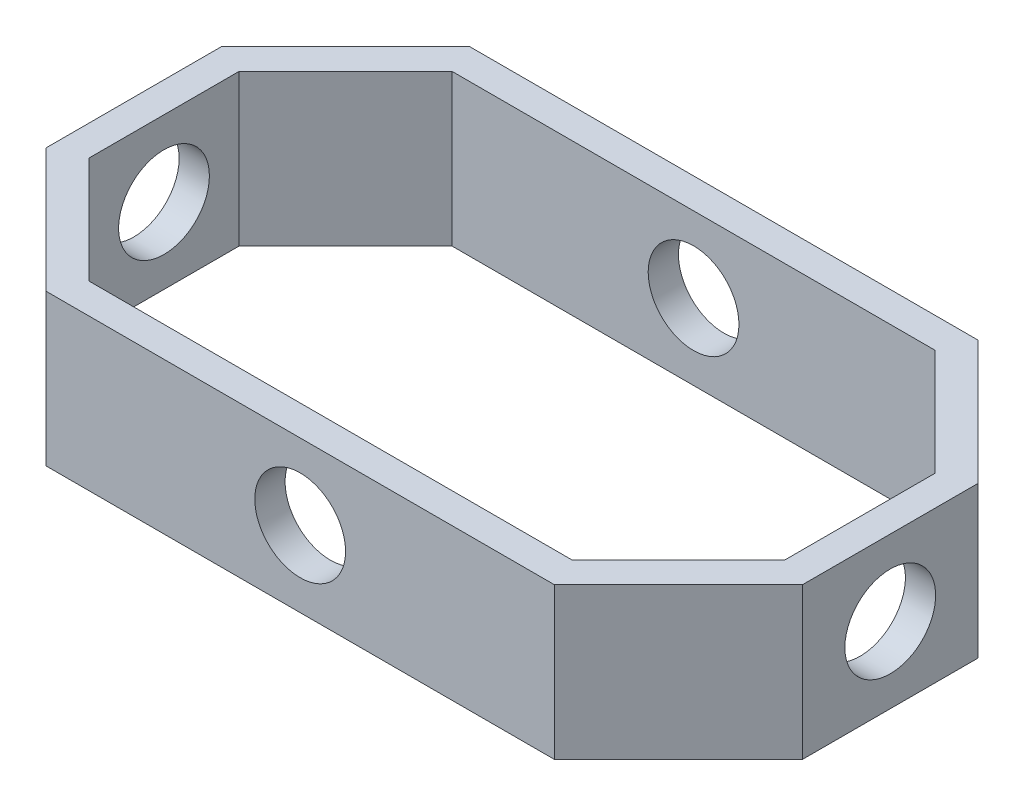
from build123d import *

# Parameters (mm, degrees)
BOSS_EXTRUDE2_DEPTH = 10
CUT_EXTRUDE2_REACH  = 40.846
SKETCH4_R           = 3
CIRPATTERN2_COUNT   = 4


with BuildPart() as part:
    # Sketch3 → Boss-Extrude2 (new body)
    with BuildSketch(Plane(origin=(0, 0, 0), x_dir=(1, 0, 0), z_dir=(0, 1, 0))):
        Polygon((-16.798989873, -14), (16.798989873, -14), (25, -5.798989873), (25, 5.798989873), (16.798989873, 14), (-16.798989873, 14), (-25, 5.798989873), (-25, -5.798989873), align=None)
        Polygon((-23, -4.970562748), (-15.970562748, -12), (15.970562748, -12), (23, -4.970562748), (23, 4.970562748), (15.970562748, 12), (-15.970562748, 12), (-23, 4.970562748), align=None, mode=Mode.SUBTRACT)
    extrude(amount=BOSS_EXTRUDE2_DEPTH)

    # Sketch4 → Cut-Extrude2 (cut, up to next)
    with BuildSketch(Plane.XY.offset(14), mode=Mode.PRIVATE) as cut_extrude2_sk1:
        with Locations((0, 5)):
            Circle(SKETCH4_R)
    cut_extrude2_tool1 = extrude(cut_extrude2_sk1.sketch, amount=-CUT_EXTRUDE2_REACH, mode=Mode.PRIVATE) & part.part
    cut_extrude2 = cut_extrude2_tool1.solids().sort_by_distance((0, 5, 14))[0]
    add(cut_extrude2, mode=Mode.SUBTRACT)

    # CirPattern2: Cut-Extrude2; each copy of Cut-Extrude2 runs up to whatever stops it at its own place
    cirpattern2_before = part.part  # the part as the pattern finds it: every copy runs up to it
    cirpattern2_cut_extrude2_long = extrude(cut_extrude2_sk1.sketch, amount=-CUT_EXTRUDE2_REACH, mode=Mode.PRIVATE)
    cirpattern2_cut_extrude2_tool1 = cirpattern2_cut_extrude2_long.rotate(Axis((0, 0, 0), (0, 1, 0)), 1 * 360 / CIRPATTERN2_COUNT) & cirpattern2_before
    add(cirpattern2_cut_extrude2_tool1.solids().sort_by_distance((14, 5, 0))[0], mode=Mode.SUBTRACT)
    cirpattern2_cut_extrude2_tool2 = cirpattern2_cut_extrude2_long.rotate(Axis((0, 0, 0), (0, 1, 0)), 2 * 360 / CIRPATTERN2_COUNT) & cirpattern2_before
    add(cirpattern2_cut_extrude2_tool2.solids().sort_by_distance((0, 5, -14))[0], mode=Mode.SUBTRACT)
    cirpattern2_cut_extrude2_tool3 = cirpattern2_cut_extrude2_long.rotate(Axis((0, 0, 0), (0, 1, 0)), 3 * 360 / CIRPATTERN2_COUNT) & cirpattern2_before
    add(cirpattern2_cut_extrude2_tool3.solids().sort_by_distance((-14, 5, 0))[0], mode=Mode.SUBTRACT)


solid = part.part
